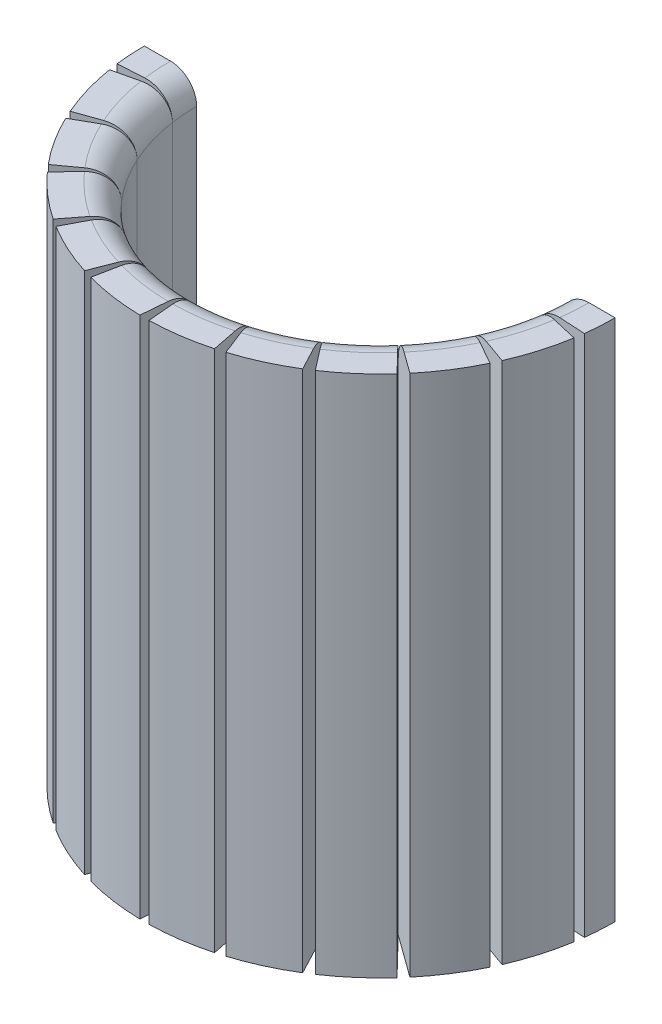
from build123d import *

# Parameters (mm, degrees)
BOSS_EXTRUDE1_DEPTH = 200
FILLET1_R           = 10
CUT_EXTRUDE1_START  = -200.000005
CUT_EXTRUDE1_DEPTH  = 200.000005


with BuildPart() as part:
    # Sketch1 → Boss-Extrude1 (new body)
    with BuildSketch(Plane(origin=(0, 0, 0), x_dir=(1, 0, 0), z_dir=(0, 1, 0))):
        with BuildLine():
            Line((90, 0), (70, 0))
            ThreePointArc((70, 0), (0, -70), (-70, 0))
            Line((-70, 0), (-90, 0))
            ThreePointArc((-90, 0), (0, -90), (90, 0))
        make_face()
    extrude(amount=BOSS_EXTRUDE1_DEPTH)

    # Fillet1
    fillet1_edges = [part.edges().sort_by_distance(p)[0] for p in [
        (0, 200, 70),
    ]]
    fillet(fillet1_edges, radius=FILLET1_R)

    # Sketch2 → Cut-Extrude1 (cut)
    with BuildSketch(Plane.XZ.offset(CUT_EXTRUDE1_START)):
        with BuildLine():
            Line((0, 70), (-1.74828752, 89.983017791))
            ThreePointArc((-1.74828752, 89.983017791), (0, 90), (1.74828752, 89.983017791))
            Line((1.74828752, 89.983017791), (0, 70))
        make_face()
        with BuildLine():
            Line((19.721278979, 67.164508153), (23.673676083, 86.830622828))
            ThreePointArc((23.673676083, 86.830622828), (25.355930116, 86.354367625), (27.028615266, 85.845523802))
            Line((27.028615266, 85.845523802), (19.721278979, 67.164508153))
        make_face()
        with BuildLine():
            Line((37.844857222, 58.887747298), (47.177739243, 76.643727205))
            ThreePointArc((47.177739243, 76.643727205), (48.657673571, 75.712817955), (50.119245348, 74.753336018))
            Line((50.119245348, 74.753336018), (37.844857222, 58.887747298))
        make_face()
        with BuildLine():
            Line((52.902470205, 45.840251376), (66.859742546, 60.247612622))
            ThreePointArc((66.859742546, 60.247612622), (68.017461692, 58.937466055), (69.149512243, 57.605077524))
            Line((69.149512243, 57.605077524), (52.902470205, 45.840251376))
        make_face()
        with BuildLine():
            Line((63.674239675, 29.07905091), (81.125167138, 38.970594771))
            ThreePointArc((81.125167138, 38.970594771), (81.866879582, 37.38735117), (82.577696904, 35.789998241))
            Line((82.577696904, 35.789998241), (63.674239675, 29.07905091))
        make_face()
        with BuildLine():
            Line((69.287500932, 9.962038679), (88.818313159, 14.536411098))
            ThreePointArc((88.818313159, 14.536411098), (89.083929769, 12.808335445), (89.31592767, 11.075426151))
            Line((89.31592767, 11.075426151), (69.287500932, 9.962038679))
        make_face()
        with BuildLine():
            Line((69.287500932, -9.962038679), (89.31592767, -11.075426151))
            ThreePointArc((89.31592767, -11.075426151), (89.083929769, -12.808335445), (88.818313159, -14.536411098))
            Line((88.818313159, -14.536411098), (69.287500932, -9.962038679))
        make_face()
        with BuildLine():
            Line((63.674239675, -29.07905091), (82.577696904, -35.789998241))
            ThreePointArc((82.577696904, -35.789998241), (81.866879582, -37.38735117), (81.125167138, -38.970594771))
            Line((81.125167138, -38.970594771), (63.674239675, -29.07905091))
        make_face()
        with BuildLine():
            Line((52.902470205, -45.840251376), (69.149512243, -57.605077524))
            ThreePointArc((69.149512243, -57.605077524), (68.017461692, -58.937466055), (66.859742546, -60.247612622))
            Line((66.859742546, -60.247612622), (52.902470205, -45.840251376))
        make_face()
        with BuildLine():
            Line((37.844857222, -58.887747298), (50.119245348, -74.753336018))
            ThreePointArc((50.119245348, -74.753336018), (48.657673571, -75.712817955), (47.177739243, -76.643727205))
            Line((47.177739243, -76.643727205), (37.844857222, -58.887747298))
        make_face()
        with BuildLine():
            Line((19.721278979, -67.164508153), (27.028615266, -85.845523802))
            ThreePointArc((27.028615266, -85.845523802), (25.355930116, -86.354367625), (23.673676083, -86.830622828))
            Line((23.673676083, -86.830622828), (19.721278979, -67.164508153))
        make_face()
        with BuildLine():
            Line((0, -70), (1.74828752, -89.983017791))
            ThreePointArc((1.74828752, -89.983017791), (0, -90), (-1.74828752, -89.983017791))
            Line((-1.74828752, -89.983017791), (0, -70))
        make_face()
        with BuildLine():
            Line((-19.721278979, -67.164508153), (-23.673676083, -86.830622828))
            ThreePointArc((-23.673676083, -86.830622828), (-25.355930116, -86.354367625), (-27.028615266, -85.845523802))
            Line((-27.028615266, -85.845523802), (-19.721278979, -67.164508153))
        make_face()
        with BuildLine():
            Line((-37.844857222, -58.887747298), (-47.177739243, -76.643727205))
            ThreePointArc((-47.177739243, -76.643727205), (-48.657673571, -75.712817955), (-50.119245348, -74.753336018))
            Line((-50.119245348, -74.753336018), (-37.844857222, -58.887747298))
        make_face()
        with BuildLine():
            Line((-52.902470205, -45.840251376), (-66.859742546, -60.247612622))
            ThreePointArc((-66.859742546, -60.247612622), (-68.017461692, -58.937466055), (-69.149512243, -57.605077524))
            Line((-69.149512243, -57.605077524), (-52.902470205, -45.840251376))
        make_face()
        with BuildLine():
            Line((-63.674239675, -29.07905091), (-81.125167138, -38.970594771))
            ThreePointArc((-81.125167138, -38.970594771), (-81.866879582, -37.38735117), (-82.577696904, -35.789998241))
            Line((-82.577696904, -35.789998241), (-63.674239675, -29.07905091))
        make_face()
        with BuildLine():
            Line((-69.287500932, -9.962038679), (-88.818313159, -14.536411098))
            ThreePointArc((-88.818313159, -14.536411098), (-89.083929769, -12.808335445), (-89.31592767, -11.075426151))
            Line((-89.31592767, -11.075426151), (-69.287500932, -9.962038679))
        make_face()
        with BuildLine():
            Line((-69.287500932, 9.962038679), (-89.31592767, 11.075426151))
            ThreePointArc((-89.31592767, 11.075426151), (-89.083929769, 12.808335445), (-88.818313159, 14.536411098))
            Line((-88.818313159, 14.536411098), (-69.287500932, 9.962038679))
        make_face()
        with BuildLine():
            Line((-63.674239675, 29.07905091), (-82.577696904, 35.789998241))
            ThreePointArc((-82.577696904, 35.789998241), (-81.866879582, 37.38735117), (-81.125167138, 38.970594771))
            Line((-81.125167138, 38.970594771), (-63.674239675, 29.07905091))
        make_face()
        with BuildLine():
            Line((-52.902470205, 45.840251376), (-69.149512243, 57.605077524))
            ThreePointArc((-69.149512243, 57.605077524), (-68.017461692, 58.937466055), (-66.859742546, 60.247612622))
            Line((-66.859742546, 60.247612622), (-52.902470205, 45.840251376))
        make_face()
        with BuildLine():
            Line((-37.844857222, 58.887747298), (-50.119245348, 74.753336018))
            ThreePointArc((-50.119245348, 74.753336018), (-48.657673571, 75.712817955), (-47.177739243, 76.643727205))
            Line((-47.177739243, 76.643727205), (-37.844857222, 58.887747298))
        make_face()
        with BuildLine():
            Line((-19.721278979, 67.164508153), (-27.028615266, 85.845523802))
            ThreePointArc((-27.028615266, 85.845523802), (-25.355930116, 86.354367625), (-23.673676083, 86.830622828))
            Line((-23.673676083, 86.830622828), (-19.721278979, 67.164508153))
        make_face()
    extrude(amount=CUT_EXTRUDE1_DEPTH, mode=Mode.SUBTRACT)


with BuildPart() as cut_extrude1_piece_1:
    # of the separate pieces the step leaves, piece 1, a body of its own (cut_extrude1_pieces)
    add(part.part.solids().sort_by_distance((-43.984331112, 200, 66.82348851))[0])


with BuildPart() as cut_extrude1_piece_2:
    # of the separate pieces the step leaves, piece 2, a body of its own (cut_extrude1_pieces)
    add(part.part.solids().sort_by_distance((-73.129479391, 200, 32.435771057))[0])


with BuildPart() as cut_extrude1_piece_3:
    # of the separate pieces the step leaves, piece 3, a body of its own (cut_extrude1_pieces)
    add(part.part.solids().sort_by_distance((42.513031709, 200, 67.769035222))[0])


with BuildPart() as cut_extrude1_piece_4:
    # of the separate pieces the step leaves, piece 4, a body of its own (cut_extrude1_pieces)
    add(part.part.solids().sort_by_distance((-23.376304376, 200, 76.508485763))[0])


with BuildPart() as cut_extrude1_piece_5:
    # of the separate pieces the step leaves, piece 5, a body of its own (cut_extrude1_pieces)
    add(part.part.solids().sort_by_distance((21.698211644, 200, 77.001218247))[0])


with BuildPart() as cut_extrude1_piece_6:
    # of the separate pieces the step leaves, piece 6, a body of its own (cut_extrude1_pieces)
    add(part.part.solids().sort_by_distance((-61.029008926, 200, 51.724849632))[0])


with BuildPart() as cut_extrude1_piece_7:
    # of the separate pieces the step leaves, piece 7, a body of its own (cut_extrude1_pieces)
    add(part.part.solids().sort_by_distance((72.402944717, 200, 34.026660082))[0])


with BuildPart() as cut_extrude1_piece_8:
    # of the separate pieces the step leaves, piece 8, a body of its own (cut_extrude1_pieces)
    add(part.part.solids().sort_by_distance((79.056534671, 200, 12.250074526))[0])


with BuildPart() as cut_extrude1_piece_9:
    # of the separate pieces the step leaves, piece 9, a body of its own (cut_extrude1_pieces)
    add(part.part.solids().sort_by_distance((59.883698779, 200, 53.046608002))[0])


with BuildPart() as cut_extrude1_piece_10:
    # of the separate pieces the step leaves, piece 10, a body of its own (cut_extrude1_pieces)
    add(part.part.solids().sort_by_distance((-0.874468484, 200, 79.995220513))[0])


with BuildPart() as cut_extrude1_piece_11:
    # of the separate pieces the step leaves, piece 11, a body of its own (cut_extrude1_pieces)
    add(part.part.solids().sort_by_distance((70, 190, 0))[0])


with BuildPart() as cut_extrude1_piece_12:
    # of the separate pieces the step leaves, piece 12, a body of its own (cut_extrude1_pieces)
    add(part.part.solids().sort_by_distance((-70, 0, 0))[0])


solid = Compound([cut_extrude1_piece_1.part, cut_extrude1_piece_2.part, cut_extrude1_piece_3.part, cut_extrude1_piece_4.part, cut_extrude1_piece_5.part, cut_extrude1_piece_6.part, cut_extrude1_piece_7.part, cut_extrude1_piece_8.part, cut_extrude1_piece_9.part, cut_extrude1_piece_10.part, cut_extrude1_piece_11.part, cut_extrude1_piece_12.part])
